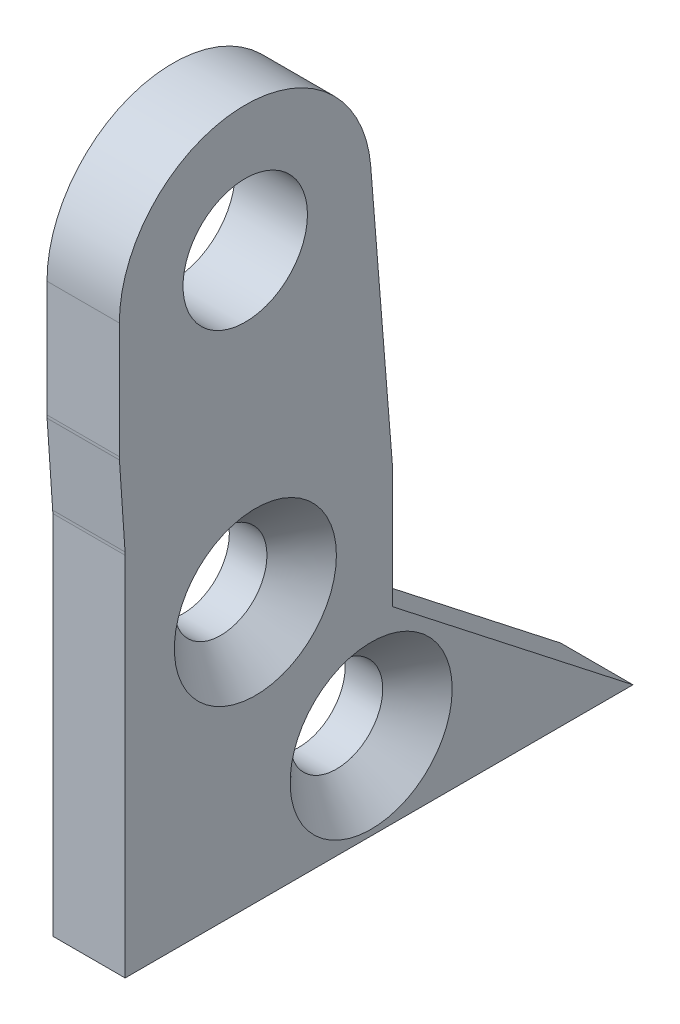
from build123d import *

# Parameters (mm, degrees)
SKETCH1_R           = 2.15
BOSS_EXTRUDE1_DEPTH = 1.25
SKETCH3_R           = 1.6
CUT_EXTRUDE1_DEPTH  = 26.195485707
CHAMFER1_SIZE       = 1.2


with BuildPart() as part:
    # Sketch1 → Boss-Extrude1 (new, symmetric)
    with BuildSketch(Plane(origin=(0, 0, 0), x_dir=(0, 0, -1), z_dir=(1, 0, 0))):
        with BuildLine():
            Line((-4.35, 0), (-4.35, -4))
            ThreePointArc((-4.35, -4), (-4.349140426, -4.050773847), (-4.346562689, -4.101489502))
            Line((-4.346562689, -4.101489502), (-4.153437311, -6.949313458))
            ThreePointArc((-4.153437311, -6.949313458), (-4.150859574, -7.000029113), (-4.15, -7.050802959))
            Line((-4.15, -7.050802959), (-4.15, -20.2))
            Line((-4.15, -20.2), (14.85, -20.2))
            Line((14.85, -20.2), (5.393870957, -12.812062296))
            Line((5.393870957, -12.812062296), (4.33601498, 0.348531342))
            ThreePointArc((4.33601498, 0.348531342), (-0.174405904, 4.346502339), (-4.35, 0))
        make_face()
        Circle(SKETCH1_R, mode=Mode.SUBTRACT)
    extrude(amount=BOSS_EXTRUDE1_DEPTH, both=True)

    # Sketch3 → Cut-Extrude1 (cut, through all)
    with BuildSketch(Plane(origin=(1.25, 0, 0), x_dir=(0, 0, -1), z_dir=(1, 0, 0))):
        with Locations((0.35, -10.7)):
            Circle(SKETCH3_R)
        with Locations((4.35, -16.7)):
            Circle(SKETCH3_R)
        Polygon((-4.15, -20.2), (14.85, -20.2), (5.393870957, -12.812062296), (5.086040219, -8.982396127), (5.086040219, -13.206067673), (13.397894561, -19.7), (-4.15, -19.7), align=None)
    extrude(amount=-CUT_EXTRUDE1_DEPTH, mode=Mode.SUBTRACT)

    # Chamfer1
    chamfer1_edges = [part.edges().sort_by_distance(p)[0] for p in [
        (1.25, -16.7, -2.75),
        (1.25, -10.7, 1.25),
    ]]
    chamfer(chamfer1_edges, length=CHAMFER1_SIZE)


solid = part.part
